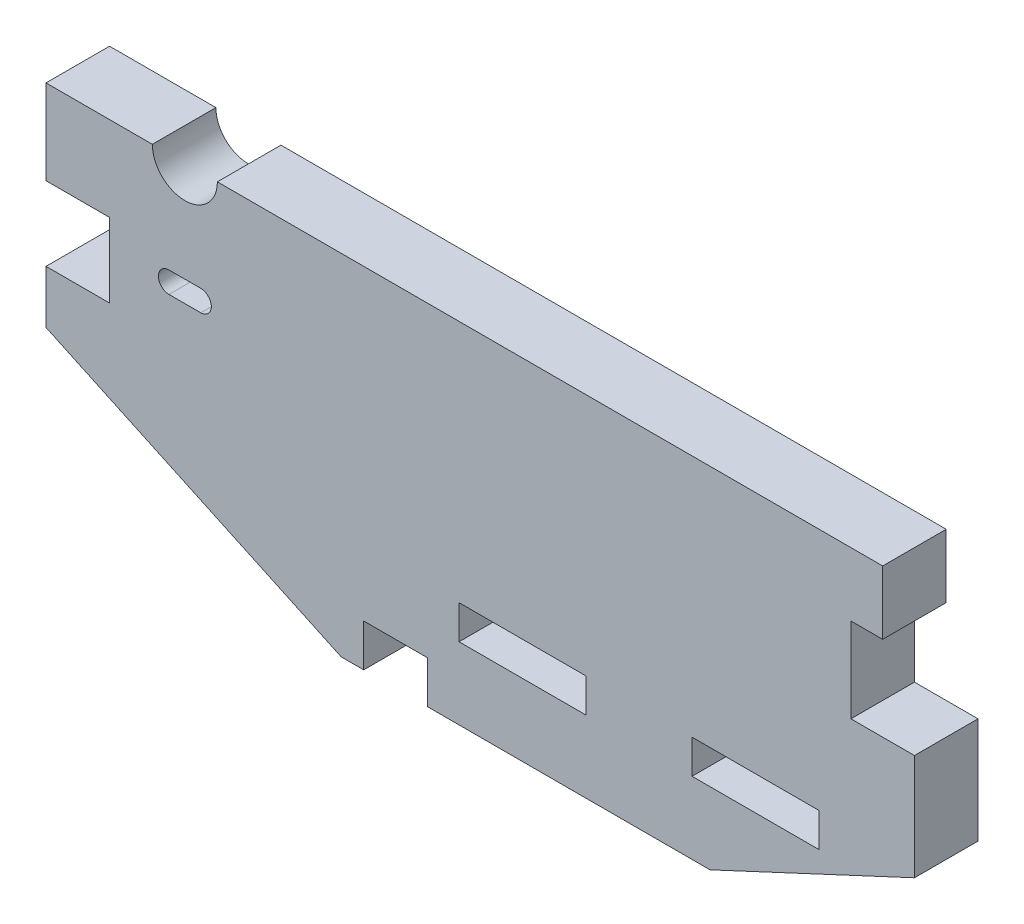
from build123d import *

# Parameters (mm, degrees)
ESQUISSE1_W             = 82
ESQUISSE1_H             = 33
BOSS_EXTRU_1_DEPTH      = 6
ENL_V_MAT_EXTRU_1_DEPTH = 10
ESQUISSE3_W             = 6
ESQUISSE3_H             = 7
ENL_V_MAT_EXTRU_2_DEPTH = 89.594582227
CHANFREIN1_SIZE         = 13
CHANFREIN1_SIZE2        = 27.878589967
CHANFREIN2_SIZE         = 9
CHANFREIN2_SIZE2        = 19.300562285
ESQUISSE4_W             = 12
ESQUISSE4_H             = 3.2
ENL_V_MAT_EXTRU_3_DEPTH = 10
ESQUISSE5_R             = 3.070048726
ENL_V_MAT_EXTRU_4_DEPTH = 10
ESQUISSE6_W             = 6
ESQUISSE6_H             = 9
ENL_V_MAT_EXTRU_5_DEPTH = 89.594582227


with BuildPart() as part:
    # Esquisse1 → Boss.-Extru.1 (new body)
    with BuildSketch(Plane.XY):
        with Locations((41, 16.5)):
            Rectangle(ESQUISSE1_W, ESQUISSE1_H)
    extrude(amount=BOSS_EXTRU_1_DEPTH)

    # Esquisse2 → Enlèv. mat.-Extru.1 (cut)
    with BuildSketch(Plane.XY.offset(6)):
        Polygon((82, 33), (79, 33), (79, 27), (76, 27), (76, 19), (82, 19), align=None)
    extrude(amount=-ENL_V_MAT_EXTRU_1_DEPTH, mode=Mode.SUBTRACT)

    # Esquisse3 → Enlèv. mat.-Extru.2 (cut, through all)
    with BuildSketch(Plane.XY.offset(6)):
        with Locations((3, 21.5)):
            Rectangle(ESQUISSE3_W, ESQUISSE3_H)
    extrude(amount=-ENL_V_MAT_EXTRU_2_DEPTH, mode=Mode.SUBTRACT)

    # Chanfrein1
    chanfrein1_edges = [part.edges().sort_by_distance(p)[0] for p in [
        (0, 0, 3),
    ]]
    chanfrein1_side = [part.faces().sort_by_distance(p)[0] for p in [
        (0, 9, 3),
    ]]
    chamfer(chanfrein1_edges, length=CHANFREIN1_SIZE, length2=CHANFREIN1_SIZE2, reference=chanfrein1_side[0])

    # Chanfrein2
    chanfrein2_edges = [part.edges().sort_by_distance(p)[0] for p in [
        (82, 0, 3),
    ]]
    chanfrein2_side = [part.faces().sort_by_distance(p)[0] for p in [
        (82, 9.5, 3),
    ]]
    chamfer(chanfrein2_edges, length=CHANFREIN2_SIZE, length2=CHANFREIN2_SIZE2, reference=chanfrein2_side[0])

    # Esquisse4 → Enlèv. mat.-Extru.3 (cut)
    with BuildSketch(Plane.XY.offset(6)):
        with Locations((45, 8.4)):
            Rectangle(ESQUISSE4_W, ESQUISSE4_H)
        with Locations((67, 8.4)):
            Rectangle(ESQUISSE4_W, ESQUISSE4_H)
    extrude(amount=-ENL_V_MAT_EXTRU_3_DEPTH, mode=Mode.SUBTRACT)

    # Esquisse5 → Enlèv. mat.-Extru.4 (cut)
    with BuildSketch(Plane.XY.offset(6)):
        with Locations((13.110300044, 33)):
            Circle(ESQUISSE5_R)
        with BuildLine():
            Line((448.809841118, 61.994892284), (448.809841118, 59.994892284))
            ThreePointArc((448.809841118, 59.994892284), (447.809841118, 58.994892284), (446.809841118, 59.994892284))
            Line((446.809841118, 59.994892284), (446.809841118, 61.994892284))
            ThreePointArc((446.809841118, 61.994892284), (447.809841118, 62.994892284), (448.809841118, 61.994892284))
        make_face()
        with BuildLine():
            Line((442.809841118, 61.994892284), (442.809841118, 59.994892284))
            ThreePointArc((442.809841118, 59.994892284), (441.809841118, 58.994892284), (440.809841118, 59.994892284))
            Line((440.809841118, 59.994892284), (440.809841118, 61.994892284))
            ThreePointArc((440.809841118, 61.994892284), (441.809841118, 62.994892284), (442.809841118, 61.994892284))
        make_face()
        with BuildLine():
            Line((442.809841118, 86.994892284), (442.809841118, 84.994892284))
            ThreePointArc((442.809841118, 84.994892284), (441.809841118, 83.994892284), (440.809841118, 84.994892284))
            Line((440.809841118, 84.994892284), (440.809841118, 86.994892284))
            ThreePointArc((440.809841118, 86.994892284), (441.809841118, 87.994892284), (442.809841118, 86.994892284))
        make_face()
        with BuildLine():
            Line((442.809841118, 111.994892284), (442.809841118, 109.994892284))
            ThreePointArc((442.809841118, 109.994892284), (441.809841118, 108.994892284), (440.809841118, 109.994892284))
            Line((440.809841118, 109.994892284), (440.809841118, 111.994892284))
            ThreePointArc((440.809841118, 111.994892284), (441.809841118, 112.994892284), (442.809841118, 111.994892284))
        make_face()
        with BuildLine():
            Line((442.809841118, 136.994892284), (442.809841118, 134.994892284))
            ThreePointArc((442.809841118, 134.994892284), (441.809841118, 133.994892284), (440.809841118, 134.994892284))
            Line((440.809841118, 134.994892284), (440.809841118, 136.994892284))
            ThreePointArc((440.809841118, 136.994892284), (441.809841118, 137.994892284), (442.809841118, 136.994892284))
        make_face()
        with BuildLine():
            Line((448.809841118, 86.994892284), (448.809841118, 84.994892284))
            ThreePointArc((448.809841118, 84.994892284), (447.809841118, 83.994892284), (446.809841118, 84.994892284))
            Line((446.809841118, 84.994892284), (446.809841118, 86.994892284))
            ThreePointArc((446.809841118, 86.994892284), (447.809841118, 87.994892284), (448.809841118, 86.994892284))
        make_face()
        with BuildLine():
            Line((448.809841118, 111.994892284), (448.809841118, 109.994892284))
            ThreePointArc((448.809841118, 109.994892284), (447.809841118, 108.994892284), (446.809841118, 109.994892284))
            Line((446.809841118, 109.994892284), (446.809841118, 111.994892284))
            ThreePointArc((446.809841118, 111.994892284), (447.809841118, 112.994892284), (448.809841118, 111.994892284))
        make_face()
        with BuildLine():
            Line((448.809841118, 136.994892284), (448.809841118, 134.994892284))
            ThreePointArc((448.809841118, 134.994892284), (447.809841118, 133.994892284), (446.809841118, 134.994892284))
            Line((446.809841118, 134.994892284), (446.809841118, 136.994892284))
            ThreePointArc((446.809841118, 136.994892284), (447.809841118, 137.994892284), (448.809841118, 136.994892284))
        make_face()
        with BuildLine():
            Line((11.610300044, 23.509087354), (14.610300044, 23.509087354))
            ThreePointArc((14.610300044, 23.509087354), (15.610300044, 22.509087354), (14.610300044, 21.509087354))
            Line((14.610300044, 21.509087354), (11.610300044, 21.509087354))
            ThreePointArc((11.610300044, 21.509087354), (10.610300044, 22.509087354), (11.610300044, 23.509087354))
        make_face()
    extrude(amount=-ENL_V_MAT_EXTRU_4_DEPTH, mode=Mode.SUBTRACT)

    # Esquisse6 → Enlèv. mat.-Extru.5 (cut, through all)
    with BuildSketch(Plane.XY.offset(6)):
        with Locations((33, -0.5)):
            Rectangle(ESQUISSE6_W, ESQUISSE6_H)
    extrude(amount=-ENL_V_MAT_EXTRU_5_DEPTH, mode=Mode.SUBTRACT)


solid = part.part
